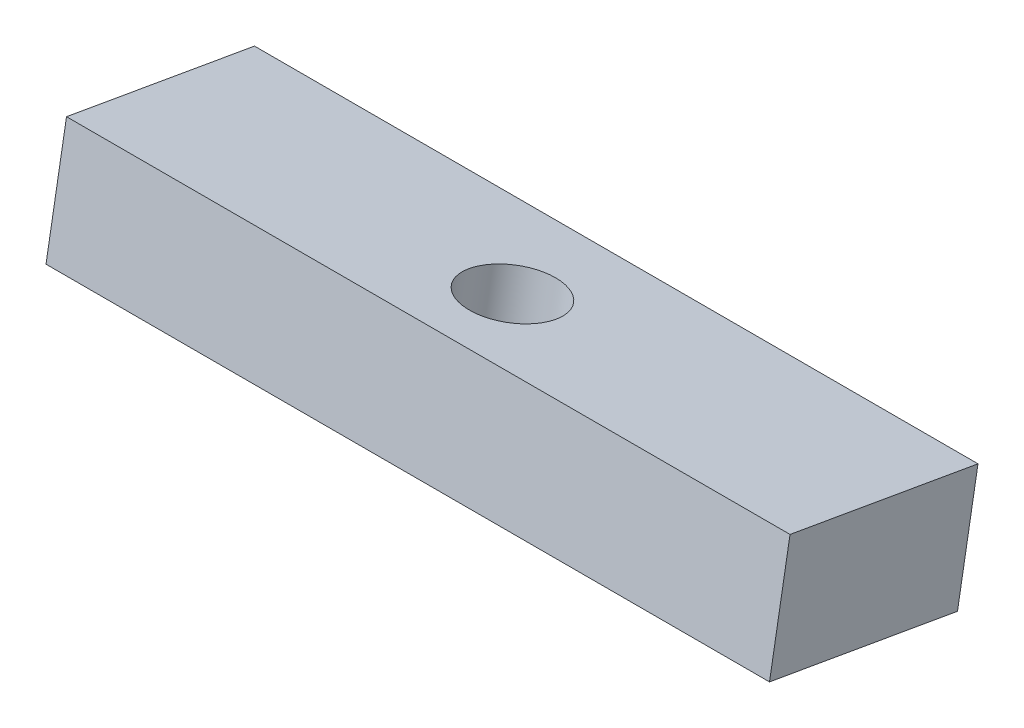
from build123d import *

# Parameters (mm, degrees)
SKETCH1_R           = 1.1
BOSS_EXTRUDE1_DEPTH = 3


with BuildPart() as part:
    # Sketch1 → Boss-Extrude1 (new body)
    with BuildSketch(Plane(origin=(0, 182.8877177, -31.932083898), x_dir=(1, 0, 0), z_dir=(0, -0.9850974025792159, 0.17199740530508756))):
        Polygon((-15.65, -70.86490771), (2.55, -70.86490771), (2.55, -66.06490771), (-6, -66.06490771), (-7.1, -66.06490771), (-15.65, -66.06490771), align=None)
        with Locations(Location((-6.55, -68.21490771, 0), (0, 0, 270))):
            Circle(SKETCH1_R, mode=Mode.SUBTRACT)
    extrude(amount=BOSS_EXTRUDE1_DEPTH)


solid = part.part
